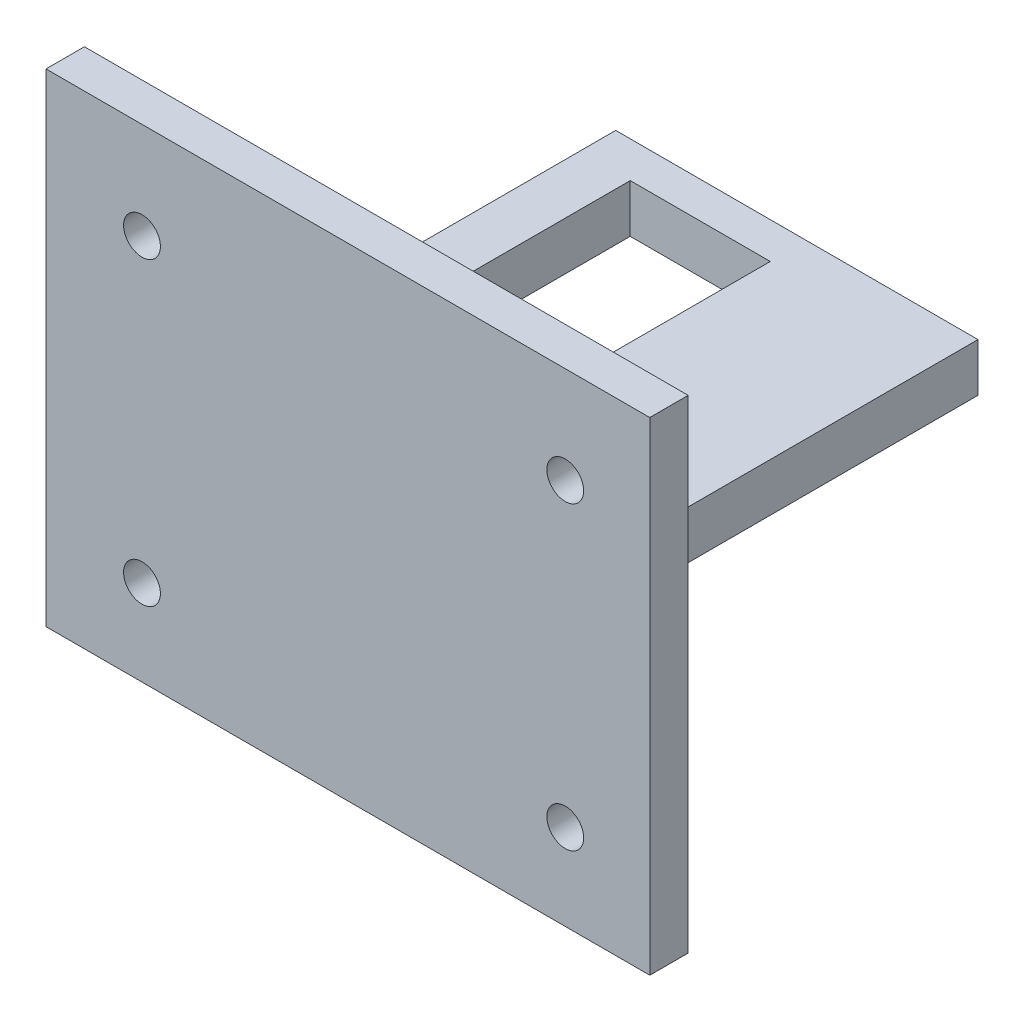
from build123d import *

# Parameters (mm, degrees)
SKETCH1_W               = 50
SKETCH1_H               = 40
BOSS_EXTRUDE1_DEPTH     = 3.18
SKETCH4_W               = 30
SKETCH4_H               = 4
BOSS_EXTRUDE2_DEPTH     = 36
CUT_EXTRUDE1_DEPTH      = 50.040799341
CUT_EXTRUDE1_DEPTH_BACK = 50.040799341
SKETCH8_W               = 11.6
SKETCH8_H               = 22.1
SKETCH8_R               = 1
SKETCH9_R               = 1.525
CUT_EXTRUDE2_DEPTH      = 49.176757882
FILLET4_R               = 3
SKETCH12_W              = 30
SKETCH12_H              = 2
CUT_EXTRUDE3_DEPTH      = 50.040799341


with BuildPart() as part:
    # Sketch1 → Boss-Extrude1 (new body)
    with BuildSketch(Plane.XY):
        Rectangle(SKETCH1_W, SKETCH1_H)
    extrude(amount=BOSS_EXTRUDE1_DEPTH)

    # Sketch4 → Boss-Extrude2 (add)
    with BuildSketch(Plane(origin=(0, 0, 0), x_dir=(-1, 0, 0), z_dir=(0, 0, -1))):
        Rectangle(SKETCH4_W, SKETCH4_H)
    extrude(amount=BOSS_EXTRUDE2_DEPTH)

    # Sketch8 → Cut-Extrude1 (cut, two sides: drawn at the far end of the back side and taken through both)
    with BuildSketch(Plane(origin=(0, 2, 0), x_dir=(1, 0, 0), z_dir=(0, 1, 0)).offset(-CUT_EXTRUDE1_DEPTH_BACK)):
        with Locations((-5, 19.95)):
            Rectangle(SKETCH8_W, SKETCH8_H)
        with Locations((-5, 6.325)):
            Circle(SKETCH8_R)
    extrude(amount=CUT_EXTRUDE1_DEPTH + CUT_EXTRUDE1_DEPTH_BACK, mode=Mode.SUBTRACT)

    # Sketch9 → Cut-Extrude2 (cut, through all)
    with BuildSketch(Plane(origin=(0, 0, 0), x_dir=(-1, 0, 0), z_dir=(0, 0, -1))):
        with Locations((-18, 12)):
            Circle(SKETCH9_R)
        with Locations((17.0502, 12)):
            Circle(SKETCH9_R)
        with Locations((17.05, -12.889999999)):
            Circle(SKETCH9_R)
        with Locations((-18, -12.889999999)):
            Circle(SKETCH9_R)
    extrude(amount=-CUT_EXTRUDE2_DEPTH, mode=Mode.SUBTRACT)

    # Fillet4
    fillet4_edges = [part.edges().sort_by_distance(p)[0] for p in [
        (0, -2, 0),
    ]]
    fillet(fillet4_edges, radius=FILLET4_R)

    # Sketch12 → Cut-Extrude3 (cut, through all)
    with BuildSketch(Plane.XZ.offset(2)):
        with Locations((0, -35)):
            Rectangle(SKETCH12_W, SKETCH12_H)
    extrude(amount=-CUT_EXTRUDE3_DEPTH, mode=Mode.SUBTRACT)


solid = part.part
